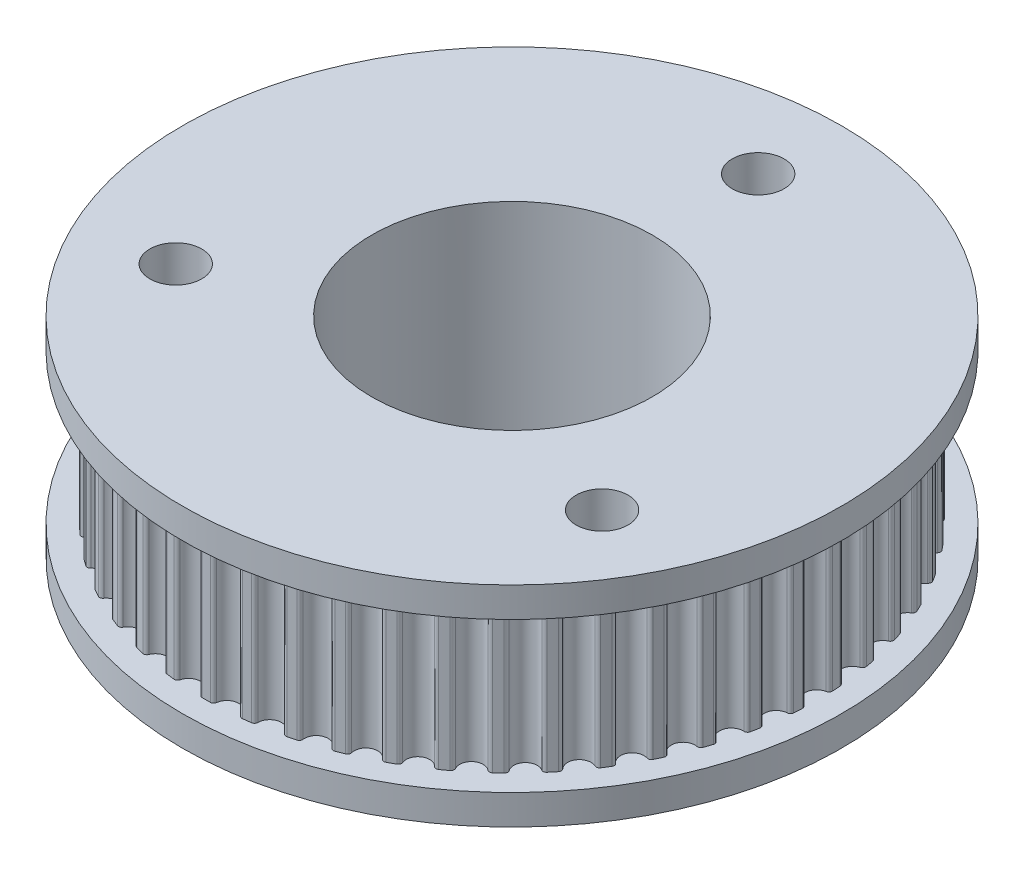
from build123d import *

# Parameters (mm, degrees)
MOUNTINGHOLES_R         = 39.751
BOSS_EXTRUDE1_DEPTH     = 9.525
CUT_EXTRUDE1_DEPTH      = 19.05
CIRPATTERN1_COUNT       = 50
FLANGE_R                = 41.91
BOSS_EXTRUDE2_DEPTH     = 3.81
BOSS_EXTRUDE3_START     = 3.81
SKETCH6_R               = 41.91
BOSS_EXTRUDE3_DEPTH     = 3.81
CUT_EXTRUDE5_DEPTH      = 32.512
CUT_EXTRUDE5_DEPTH_BACK = 31.242
SKETCH1_5_R             = 3.302
SKETCH1_5_R_2           = 17.8435


with BuildPart() as part:
    # mountingHoles → Boss-Extrude1 (new, symmetric)
    with BuildSketch(Plane(origin=(0, 0, 0), x_dir=(1, 0, 0), z_dir=(0, 1, 0))):
        Circle(MOUNTINGHOLES_R)
    extrude(amount=BOSS_EXTRUDE1_DEPTH, both=True)

    # Sketch2 → Cut-Extrude1 (cut)
    with BuildSketch(Plane(origin=(0, 9.525, 0), x_dir=(1, 0, 0), z_dir=(0, 1, 0))):
        with BuildLine():
            Line((0, 38.8874), (0, 39.751))
            ThreePointArc((0, 39.751), (2.495985942, 39.672560482), (4.982121367, 39.437551492))
            Line((4.982121367, 39.437551492), (4.873883587, 38.580761236))
            ThreePointArc((4.873883587, 38.580761236), (4.614115167, 38.612689883), (4.354137743, 38.642869501))
            ThreePointArc((4.354137743, 38.642869501), (4.059877913, 38.568719188), (3.887072562, 38.319268939))
            ThreePointArc((3.887072562, 38.319268939), (2.339778754, 37.18971833), (0.94625605, 38.504289431))
            ThreePointArc((0.94625605, 38.504289431), (0.806077727, 38.773430944), (0.523431722, 38.883877096))
            ThreePointArc((0.523431722, 38.883877096), (0.261721789, 38.886519264), (0, 38.8874))
        make_face()
    cut_extrude1 = extrude(amount=-CUT_EXTRUDE1_DEPTH, mode=Mode.SUBTRACT)

    # CirPattern1: Cut-Extrude1 ×50 about axis
    cirpattern1_axis = Axis((0, 9.525, 0), (0, -1, 0))
    for i in range(1, CIRPATTERN1_COUNT):
        add(cut_extrude1.rotate(cirpattern1_axis, i * 360 / CIRPATTERN1_COUNT), mode=Mode.SUBTRACT)

    # flange → Boss-Extrude2 (add)
    with BuildSketch(Plane(origin=(0, 9.525, 0), x_dir=(1, 0, 0), z_dir=(0, 1, 0))):
        Circle(FLANGE_R)
    extrude(amount=BOSS_EXTRUDE2_DEPTH)

    # Sketch6 → Boss-Extrude3 (add)
    with BuildSketch(Plane.XZ.offset(9.525).offset(BOSS_EXTRUDE3_START)):
        Circle(SKETCH6_R)
    extrude(amount=-BOSS_EXTRUDE3_DEPTH)

    # Sketch1<5> → Cut-Extrude5 (cut, two sides: drawn at the far end of the back side and taken through both)
    with BuildSketch(Plane(origin=(0, 0, 0), x_dir=(1, 0, 0), z_dir=(0, 1, 0)).offset(-CUT_EXTRUDE5_DEPTH_BACK)):
        with Locations((0, 31.3055)):
            Circle(SKETCH1_5_R)
        with Locations((27.111358278, -15.65275)):
            Circle(SKETCH1_5_R)
        with Locations((-27.111358278, -15.65275)):
            Circle(SKETCH1_5_R)
        Circle(SKETCH1_5_R_2)
    extrude(amount=CUT_EXTRUDE5_DEPTH + CUT_EXTRUDE5_DEPTH_BACK, mode=Mode.SUBTRACT)


solid = part.part
